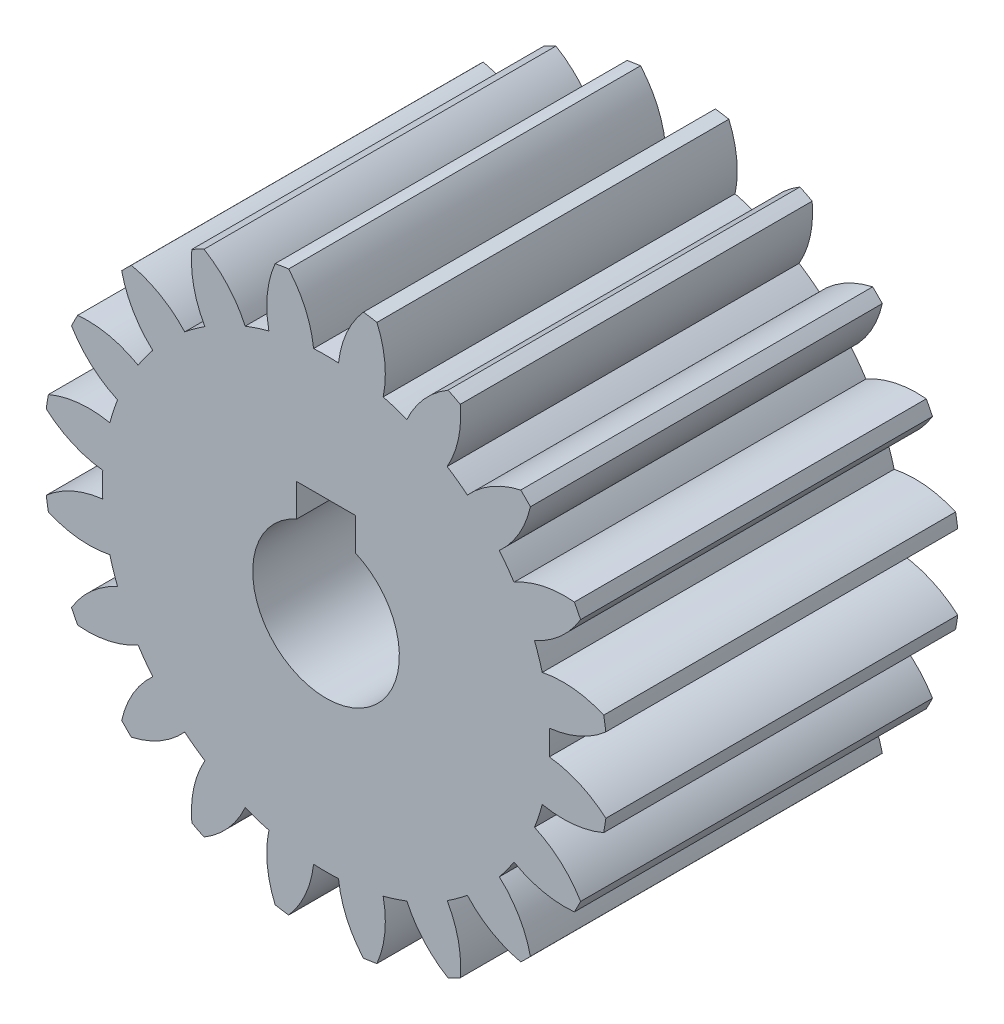
from build123d import *

# Parameters (mm, degrees)
SKETCH1_R           = 19.25
BOSS_EXTRUDE1_DEPTH = 12
CUT_EXTRUDE1_DEPTH  = 37.292216796
CIRPATTERN1_COUNT   = 20
CUT_EXTRUDE2_DEPTH  = 37.112601679


with BuildPart() as part:
    # Sketch1 → Boss-Extrude1 (new, symmetric)
    with BuildSketch(Plane.XY):
        Circle(SKETCH1_R)
    extrude(amount=BOSS_EXTRUDE1_DEPTH, both=True)

    # Sketch2 → Cut-Extrude1 (cut, through all)
    with BuildSketch(Plane.XY.offset(12)):
        with BuildLine():
            ThreePointArc((0.85, 15.226293049), (0, 15.25), (-0.85, 15.226293049))
            ThreePointArc((-0.85, 15.226293049), (-1.403219848, 17.284232339), (-2.55, 19.080356391))
            ThreePointArc((-2.55, 19.080356391), (0, 19.25), (2.55, 19.080356391))
            ThreePointArc((2.55, 19.080356391), (1.403219848, 17.284232339), (0.85, 15.226293049))
        make_face()
    cut_extrude1 = extrude(amount=-CUT_EXTRUDE1_DEPTH, mode=Mode.SUBTRACT)

    # CirPattern1: Cut-Extrude1 ×20 about axis
    cirpattern1_axis = Axis((0, 0, 0), (0, 0, 1))
    for i in range(1, CIRPATTERN1_COUNT):
        add(cut_extrude1.rotate(cirpattern1_axis, i * 360 / CIRPATTERN1_COUNT), mode=Mode.SUBTRACT)

    # Sketch3 → Cut-Extrude2 (cut, through all)
    with BuildSketch(Plane.XY.offset(12)):
        with BuildLine():
            Line((2, 6.8), (2, 4.582575695))
            ThreePointArc((2, 4.582575695), (0, -5), (-2, 4.582575695))
            Line((-2, 4.582575695), (-2, 6.8))
            Line((-2, 6.8), (2, 6.8))
        make_face()
    extrude(amount=-CUT_EXTRUDE2_DEPTH, mode=Mode.SUBTRACT)


solid = part.part
